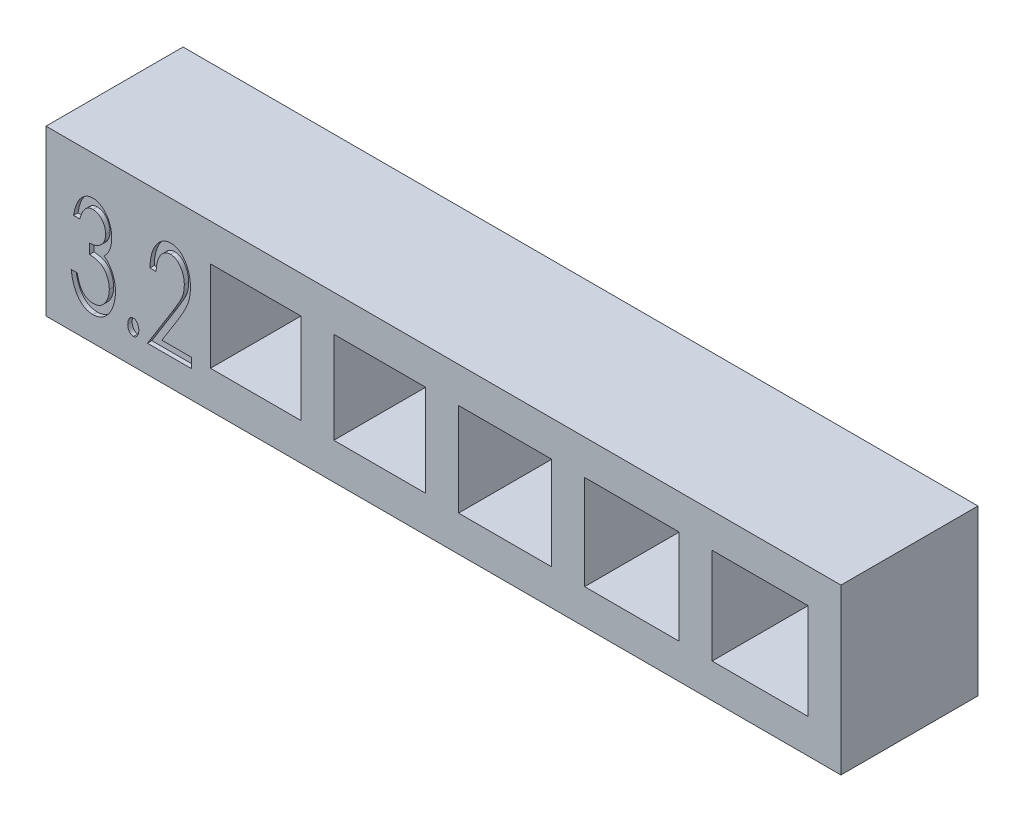
from build123d import *

# Parameters (mm, degrees)
SKETCH1_W           = 29
SKETCH1_H           = 6
SKETCH1_W_2         = 3.3
SKETCH1_H_2         = 3.3
SKETCH1_W_3         = 3.35
SKETCH1_H_3         = 3.35
SKETCH1_W_4         = 3.4
SKETCH1_H_4         = 3.4
SKETCH1_W_5         = 3.45
SKETCH1_H_5         = 3.45
SKETCH1_W_6         = 3.5
SKETCH1_H_6         = 3.5
BOSS_EXTRUDE1_DEPTH = 5
CUT_EXTRUDE1_DEPTH  = 0.16


with BuildPart() as part:
    # Sketch1 → Boss-Extrude1 (new body)
    with BuildSketch(Plane.XY):
        with Locations((14.5, 3)):
            Rectangle(SKETCH1_W, SKETCH1_H)
        with Locations((7.65, 3)):
            Rectangle(SKETCH1_W_2, SKETCH1_H_2, mode=Mode.SUBTRACT)
        with Locations((12.175, 3)):
            Rectangle(SKETCH1_W_3, SKETCH1_H_3, mode=Mode.SUBTRACT)
        with Locations((16.75, 3)):
            Rectangle(SKETCH1_W_4, SKETCH1_H_4, mode=Mode.SUBTRACT)
        with Locations((21.375, 3)):
            Rectangle(SKETCH1_W_5, SKETCH1_H_5, mode=Mode.SUBTRACT)
        with Locations((26.05, 3)):
            Rectangle(SKETCH1_W_6, SKETCH1_H_6, mode=Mode.SUBTRACT)
    extrude(amount=BOSS_EXTRUDE1_DEPTH)

    # Sketch3 → Cut-Extrude1 (cut)
    with BuildSketch(Plane.XY.offset(5)):
        with BuildLine():
            Line((1.231922034, 3.68364308), (1.00756306, 3.68364308))
            add(Edge.make_bspline(
                [(1.00756306, 3.68364308), (1.013243401, 3.718773559), (1.024282222, 3.787043943), (1.047016769, 3.885777919), (1.073549564, 3.978201514), (1.103603208, 4.064639771), (1.13719106, 4.144802315), (1.174483397, 4.218939034), (1.215410595, 4.287128605), (1.261424975, 4.348059006), (1.309323242, 4.402868522), (1.360180855, 4.45018759), (1.412960834, 4.490452247), (1.467760787, 4.523823712), (1.525309879, 4.549368735), (1.584916479, 4.567340294), (1.646509545, 4.579326108), (1.688296162, 4.580491036), (1.709385976, 4.581078978)],
                knots=[0, 0, 0, 0, 1.375500198, 2.673061445, 3.914154514, 5.091447837, 6.209049737, 7.271761046, 8.297573281, 9.278805903, 10.219733474, 11.108365601, 11.95950585, 12.78231147, 13.583195793, 14.386319503, 15.185571241, 16, 16, 16, 16], degree=3))
            add(Edge.make_bspline(
                [(1.709385976, 4.581078978), (1.740160253, 4.579663973), (1.801711479, 4.576833841), (1.891811621, 4.551606823), (1.978490119, 4.511637396), (2.060871656, 4.456837066), (2.137003715, 4.388606226), (2.205756852, 4.309242852), (2.263008002, 4.217321435), (2.3116309, 4.116884552), (2.350715161, 4.010034661), (2.377671124, 3.899207788), (2.395495185, 3.786348952), (2.39755247, 3.710119789), (2.398588701, 3.67172401)],
                knots=[0, 0, 0, 0, 0.877359105, 1.754794358, 2.650690736, 3.594712977, 4.568509496, 5.562406947, 6.582555176, 7.651131429, 8.744757127, 9.824405285, 10.904177203, 12, 12, 12, 12], degree=3))
            add(Edge.make_bspline(
                [(2.398588701, 3.67172401), (2.397881608, 3.634755174), (2.396502785, 3.562666332), (2.382828847, 3.457493742), (2.360600123, 3.358088646), (2.328949396, 3.264620558), (2.288832859, 3.176784415), (2.239527773, 3.095123061), (2.181072795, 3.01916797), (2.135516295, 2.974306526), (2.112531008, 2.951671926)],
                knots=[0, 0, 0, 0, 1.110944838, 2.16633074, 3.182222826, 4.16875185, 5.127645918, 6.079590169, 7.031067565, 8, 8, 8, 8], degree=3))
            add(Edge.make_bspline(
                [(2.112531008, 2.951671926), (2.139556773, 2.933523297), (2.194078181, 2.896910499), (2.265636824, 2.826621208), (2.330322652, 2.745396991), (2.365696132, 2.68434989), (2.383865143, 2.652994042)],
                knots=[0, 0, 0, 0, 0.955545385, 1.92770423, 2.935599049, 4, 4, 4, 4], degree=3))
            add(Edge.make_bspline(
                [(2.383865143, 2.652994042), (2.395933095, 2.629801748), (2.420148386, 2.583264593), (2.449548159, 2.510204022), (2.476122093, 2.435574883), (2.496879691, 2.35863523), (2.512942791, 2.279679975), (2.525039844, 2.198740544), (2.532138279, 2.115596711), (2.532847226, 2.059390958), (2.533204085, 2.03109901)],
                knots=[0, 0, 0, 0, 0.970436241, 1.947256364, 2.921759913, 3.911414579, 4.903844001, 5.91287372, 6.949415926, 8, 8, 8, 8], degree=3))
            add(Edge.make_bspline(
                [(2.533204085, 2.03109901), (2.531840731, 1.98217979), (2.529134796, 1.885086722), (2.507882271, 1.741221424), (2.474727367, 1.60060242), (2.42698787, 1.465820288), (2.369455497, 1.339772378), (2.300440736, 1.226844594), (2.220921876, 1.129398363), (2.132350197, 1.047488687), (2.036060656, 0.981795246), (1.932262603, 0.936382557), (1.823471265, 0.906376861), (1.748613202, 0.903198028), (1.71078822, 0.901591798)],
                knots=[0, 0, 0, 0, 1.137687875, 2.258041034, 3.376373692, 4.494124616, 5.579086693, 6.594632821, 7.564433768, 8.495651269, 9.392931365, 10.261890273, 11.121751674, 12, 12, 12, 12], degree=3))
            add(Edge.make_bspline(
                [(1.71078822, 0.901591798), (1.685272919, 0.9024463), (1.635126931, 0.904125678), (1.561288547, 0.916057884), (1.491058509, 0.937382273), (1.42386542, 0.966452365), (1.359613985, 1.00295985), (1.298973623, 1.048281485), (1.241990027, 1.102236641), (1.188047582, 1.163842308), (1.138264832, 1.233708731), (1.092613967, 1.311034326), (1.0519072, 1.396233706), (1.016779153, 1.489193816), (0.98391808, 1.58906885), (0.957131991, 1.696938086), (0.934514003, 1.812558775), (0.923499432, 1.892446704), (0.91781947, 1.93364308)],
                knots=[0, 0, 0, 0, 0.85583928, 1.682006629, 2.500512869, 3.311702452, 4.133393917, 4.973833608, 5.844623799, 6.761352128, 7.716465574, 8.718160193, 9.770134925, 10.879552414, 12.049769242, 13.295223006, 14.605208397, 16, 16, 16, 16], degree=3))
            Line((0.91781947, 1.93364308), (1.142178444, 1.93364308))
            add(Edge.make_bspline(
                [(1.142178444, 1.93364308), (1.14761477, 1.906729506), (1.158146647, 1.854589434), (1.176277372, 1.779425222), (1.196332961, 1.710060474), (1.21896207, 1.646771803), (1.242691693, 1.589135471), (1.26782324, 1.5369475), (1.294767907, 1.490528246), (1.315337787, 1.463019579), (1.325171233, 1.449869042)],
                knots=[0, 0, 0, 0, 1.262847537, 2.446533554, 3.555471567, 4.582277293, 5.536519786, 6.421134418, 7.245222226, 8, 8, 8, 8], degree=3))
            add(Edge.make_bspline(
                [(1.325171233, 1.449869042), (1.337943241, 1.434844308), (1.363048288, 1.405311235), (1.405596117, 1.36678855), (1.450186566, 1.333167989), (1.498705491, 1.307700478), (1.548551339, 1.285864522), (1.60172858, 1.271555789), (1.65715054, 1.261921949), (1.69508737, 1.261021853), (1.714293829, 1.260566157)],
                knots=[0, 0, 0, 0, 1.05425535, 2.072276296, 3.065406793, 4.033653238, 4.997689897, 5.971815539, 6.973181414, 8, 8, 8, 8], degree=3))
            add(Edge.make_bspline(
                [(1.714293829, 1.260566157), (1.736313906, 1.261183543), (1.779446969, 1.262392881), (1.842140804, 1.273525168), (1.901847022, 1.289780374), (1.957424836, 1.315189677), (2.010761041, 1.345747634), (2.059637595, 1.384934458), (2.105704687, 1.430062688), (2.147374149, 1.481886242), (2.184428403, 1.538492807), (2.218764254, 1.596896763), (2.245732306, 1.658896978), (2.269364577, 1.722349319), (2.286385876, 1.788969284), (2.300384391, 1.857407744), (2.306824948, 1.928613791), (2.308166106, 1.976637303), (2.308845111, 2.000950773)],
                knots=[0, 0, 0, 0, 0.997751748, 1.954402311, 2.880379547, 3.796231174, 4.717891192, 5.661475619, 6.62834741, 7.638131149, 8.66998115, 9.695441927, 10.706004176, 11.732012594, 12.762991193, 13.821074299, 14.896847751, 16, 16, 16, 16], degree=3))
            add(Edge.make_bspline(
                [(2.308845111, 2.000950773), (2.307982989, 2.033501183), (2.306273584, 2.098041793), (2.29014042, 2.192987824), (2.265019152, 2.284723334), (2.229941655, 2.371834663), (2.187416481, 2.45290583), (2.136061332, 2.524093072), (2.077914737, 2.584721705), (2.023181984, 2.626733865), (1.97457261, 2.654642659), (1.933691943, 2.67387603), (1.88761869, 2.689503487), (1.837398545, 2.7043214), (1.782364926, 2.716878132), (1.722684256, 2.727283321), (1.658348922, 2.735678218), (1.613817909, 2.739412986), (1.590896393, 2.741335388)],
                knots=[0, 0, 0, 0, 1.34076997, 2.658464524, 3.957967947, 5.254933589, 6.522038329, 7.72257434, 8.860361428, 9.974034444, 10.552372612, 11.168698395, 11.83292926, 12.555450681, 13.326621727, 14.158131963, 15.051932463, 16, 16, 16, 16], degree=3))
            Line((1.590896393, 2.741335388), (1.590896393, 3.100309747))
            add(Edge.make_bspline(
                [(1.590896393, 3.100309747), (1.6190357, 3.101076795), (1.674629221, 3.102592215), (1.755454605, 3.119932718), (1.833233021, 3.144651847), (1.905146513, 3.181376156), (1.970865549, 3.22487772), (2.027585335, 3.27527307), (2.075447243, 3.330682342), (2.111895748, 3.392878186), (2.139750812, 3.458539455), (2.159514348, 3.527546384), (2.171737211, 3.599307947), (2.173391618, 3.648304853), (2.174229726, 3.673126253)],
                knots=[0, 0, 0, 0, 1.10421971, 2.181555554, 3.236051397, 4.304183444, 5.343687985, 6.326269505, 7.277830125, 8.208906363, 9.147340148, 10.074783968, 11.024702548, 12, 12, 12, 12], degree=3))
            add(Edge.make_bspline(
                [(2.174229726, 3.673126253), (2.172663546, 3.709270341), (2.169604654, 3.779863028), (2.144140664, 3.881602362), (2.103325265, 3.975937255), (2.054722367, 4.046144397), (2.010755991, 4.097338886), (1.974573651, 4.130838831), (1.935944508, 4.158584681), (1.895713046, 4.182537891), (1.852733282, 4.199652984), (1.807920076, 4.212601327), (1.760836212, 4.220387058), (1.728578458, 4.221525999), (1.712190464, 4.222104619)],
                knots=[0, 0, 0, 0, 1.629228931, 3.182032171, 4.702766143, 6.244460712, 7.014423531, 7.745932124, 8.463235315, 9.157926307, 9.853257568, 10.544335998, 11.26047505, 12, 12, 12, 12], degree=3))
            add(Edge.make_bspline(
                [(1.712190464, 4.222104619), (1.685811039, 4.220748144), (1.634079247, 4.218088008), (1.55986575, 4.193032423), (1.490611064, 4.155092894), (1.439307088, 4.109500615), (1.401849856, 4.065207094), (1.373811996, 4.026634089), (1.346798698, 3.98271194), (1.322198767, 3.932827343), (1.297425721, 3.878277291), (1.27451699, 3.818194463), (1.251817687, 3.753097521), (1.238704331, 3.707319642), (1.231922034, 3.68364308)],
                knots=[0, 0, 0, 0, 1.213912982, 2.380563471, 3.57807147, 4.839367027, 5.520291779, 6.253860538, 7.038248071, 7.896919104, 8.819095369, 9.802630708, 10.863508975, 12, 12, 12, 12], degree=3))
        make_face()
        with BuildLine():
            add(Edge.make_bspline(
                [(3.183845111, 1.529796926), (3.197311979, 1.528626296), (3.224205004, 1.526288574), (3.262925138, 1.509815181), (3.297672996, 1.482168713), (3.327939749, 1.444718482), (3.353430651, 1.400435228), (3.372697508, 1.350633966), (3.384087057, 1.295902768), (3.385195321, 1.257816978), (3.385768188, 1.23813026)],
                knots=[0, 0, 0, 0, 0.825833804, 1.649171127, 2.538843511, 3.527169114, 4.587831141, 5.664290313, 6.792660985, 8, 8, 8, 8], degree=3))
            add(Edge.make_bspline(
                [(3.385768188, 1.23813026), (3.385164324, 1.218914912), (3.383982377, 1.181304624), (3.372730987, 1.127011243), (3.353238176, 1.077100757), (3.328152409, 1.032370747), (3.297682756, 0.994731695), (3.262756444, 0.967324074), (3.224377702, 0.949788952), (3.197339035, 0.947570656), (3.183845111, 0.946463593)],
                knots=[0, 0, 0, 0, 1.180258177, 2.310124738, 3.388010978, 4.462540953, 5.452176786, 6.343028615, 7.173071383, 8, 8, 8, 8], degree=3))
            add(Edge.make_bspline(
                [(3.183845111, 0.946463593), (3.170353574, 0.947572787), (3.143319691, 0.949795351), (3.10490409, 0.967297581), (3.0700151, 0.994938142), (3.038807844, 1.032126433), (3.013608704, 1.076979303), (2.995161283, 1.127170048), (2.98364902, 1.181283857), (2.982506007, 1.21890789), (2.981922034, 1.23813026)],
                knots=[0, 0, 0, 0, 0.826499711, 1.656111958, 2.546501725, 3.544857446, 4.61883009, 5.691073463, 6.820353992, 8, 8, 8, 8], degree=3))
            add(Edge.make_bspline(
                [(2.981922034, 1.23813026), (2.982474276, 1.25782426), (2.98354264, 1.295924135), (2.995194823, 1.35047515), (3.013419674, 1.400555361), (3.039023378, 1.4449606), (3.070025303, 1.481961375), (3.10473561, 1.509841438), (3.143492373, 1.5262822), (3.170380631, 1.528624169), (3.183845111, 1.529796926)],
                knots=[0, 0, 0, 0, 1.206713629, 2.334499819, 3.405324329, 4.465436947, 5.462471578, 6.351683123, 7.174593968, 8, 8, 8, 8], degree=3))
        make_face()
        with BuildLine():
            Line((4.013973316, 3.414412311), (3.789614342, 3.414412311))
            add(Edge.make_bspline(
                [(3.789614342, 3.414412311), (3.791026953, 3.456037242), (3.793794048, 3.537574308), (3.805577374, 3.656825119), (3.824732797, 3.770334713), (3.849662796, 3.87816376), (3.881301699, 3.980656415), (3.919704011, 4.077278133), (3.964835324, 4.168195692), (4.015585747, 4.252889157), (4.071832877, 4.329296596), (4.131431762, 4.396519871), (4.194376465, 4.453308993), (4.260475779, 4.500260725), (4.330534109, 4.536113637), (4.403435181, 4.562549267), (4.479764059, 4.578456791), (4.531794587, 4.58019969), (4.558043829, 4.581078978)],
                knots=[0, 0, 0, 0, 1.297044685, 2.540718129, 3.729070834, 4.880324332, 5.985502297, 7.066906567, 8.115168262, 9.143861263, 10.138268346, 11.066215908, 11.937346821, 12.773434982, 13.584102209, 14.380791367, 15.183114186, 16, 16, 16, 16], degree=3))
            add(Edge.make_bspline(
                [(4.558043829, 4.581078978), (4.58406682, 4.580203927), (4.635143885, 4.578486408), (4.709536607, 4.562889003), (4.780651677, 4.53937028), (4.847363279, 4.504411104), (4.910517334, 4.460391581), (4.969670114, 4.406699512), (5.024490541, 4.342811346), (5.074866895, 4.270375828), (5.120682587, 4.191768282), (5.161042006, 4.108645848), (5.194147017, 4.021614224), (5.22286489, 3.93172305), (5.243425638, 3.837969677), (5.258753002, 3.741053979), (5.269211778, 3.640634386), (5.269989093, 3.572425228), (5.270383572, 3.537809747)],
                knots=[0, 0, 0, 0, 0.891761707, 1.750320298, 2.597193173, 3.454252882, 4.323933789, 5.23219579, 6.187107746, 7.205893807, 8.255144488, 9.305864623, 10.371982191, 11.447226411, 12.54040718, 13.66085814, 14.812908365, 16, 16, 16, 16], degree=3))
            add(Edge.make_bspline(
                [(5.270383572, 3.537809747), (5.269459063, 3.489135856), (5.267629973, 3.392837389), (5.248440563, 3.25098948), (5.219267361, 3.113448298), (5.184412215, 3.001279581), (5.148620672, 2.91099213), (5.116908511, 2.837420283), (5.078967759, 2.758516287), (5.035044734, 2.673784943), (4.987350323, 2.582455811), (4.931740987, 2.486691489), (4.872745945, 2.383923775), (4.829814386, 2.314465451), (4.807643188, 2.278595003)],
                knots=[0, 0, 0, 0, 1.28611077, 2.544495465, 3.77696322, 5.000306008, 5.643984437, 6.344138279, 7.117951803, 7.957999182, 8.867353859, 9.841408822, 10.885236111, 12, 12, 12, 12], degree=3))
            Line((4.807643188, 2.278595003), (4.227815464, 1.350309747))
            Line((4.227815464, 1.350309747), (5.315255367, 1.350309747))
            Line((5.315255367, 1.350309747), (5.315255367, 0.991335388))
            Line((5.315255367, 0.991335388), (3.699870752, 0.991335388))
            Line((3.699870752, 0.991335388), (4.605018989, 2.439853016))
            add(Edge.make_bspline(
                [(4.605018989, 2.439853016), (4.627103454, 2.474368992), (4.669603263, 2.540792262), (4.729059435, 2.637787591), (4.783252036, 2.727278084), (4.831091661, 2.810309296), (4.872919849, 2.886282173), (4.90926537, 2.955201784), (4.938525295, 3.017620148), (4.970600945, 3.091144638), (5.001494283, 3.180355383), (5.02733656, 3.288610318), (5.043459873, 3.399669103), (5.045163285, 3.474654005), (5.046024598, 3.512569362)],
                knots=[0, 0, 0, 0, 1.252259667, 2.409874896, 3.476769317, 4.449496393, 5.338169355, 6.127231762, 6.830129708, 7.444415217, 8.578321592, 9.709547945, 10.841856079, 12, 12, 12, 12], degree=3))
            add(Edge.make_bspline(
                [(5.046024598, 3.512569362), (5.045705285, 3.536428313), (5.045077721, 3.583319644), (5.037623899, 3.652149442), (5.026729912, 3.718558372), (5.0103006, 3.7824243), (4.990290328, 3.843945251), (4.965475969, 3.902834399), (4.935913732, 3.959119223), (4.902008992, 4.012252757), (4.865224873, 4.061266135), (4.826076452, 4.104070502), (4.78498747, 4.140713305), (4.741375134, 4.169921656), (4.69607772, 4.193972431), (4.648116387, 4.209645549), (4.598451613, 4.220046348), (4.564641018, 4.221412905), (4.547527002, 4.222104619)],
                knots=[0, 0, 0, 0, 1.195946325, 2.350460179, 3.467975454, 4.568023639, 5.653933819, 6.709635605, 7.768585112, 8.838246342, 9.867263882, 10.837753356, 11.742920911, 12.620583845, 13.464497734, 14.305803424, 15.142443115, 16, 16, 16, 16], degree=3))
            add(Edge.make_bspline(
                [(4.547527002, 4.222104619), (4.529492059, 4.221378734), (4.493854449, 4.219944363), (4.441607968, 4.21011205), (4.392011124, 4.192888131), (4.344684723, 4.16954813), (4.299373654, 4.139785869), (4.256399323, 4.103144644), (4.216614633, 4.059072888), (4.178751159, 4.009555325), (4.144465634, 3.953795444), (4.11349557, 3.892692275), (4.087040438, 3.825967481), (4.06474444, 3.753925065), (4.045637715, 3.676726297), (4.031448076, 3.593959131), (4.01977961, 3.506048717), (4.015944993, 3.445529817), (4.013973316, 3.414412311)],
                knots=[0, 0, 0, 0, 0.810378014, 1.601332232, 2.378500311, 3.162873048, 3.966828608, 4.808649696, 5.693150465, 6.629974261, 7.60629017, 8.630194302, 9.704767081, 10.827479045, 12.017020653, 13.275760701, 14.599255253, 16, 16, 16, 16], degree=3))
        make_face()
    extrude(amount=-CUT_EXTRUDE1_DEPTH, mode=Mode.SUBTRACT)


solid = part.part
